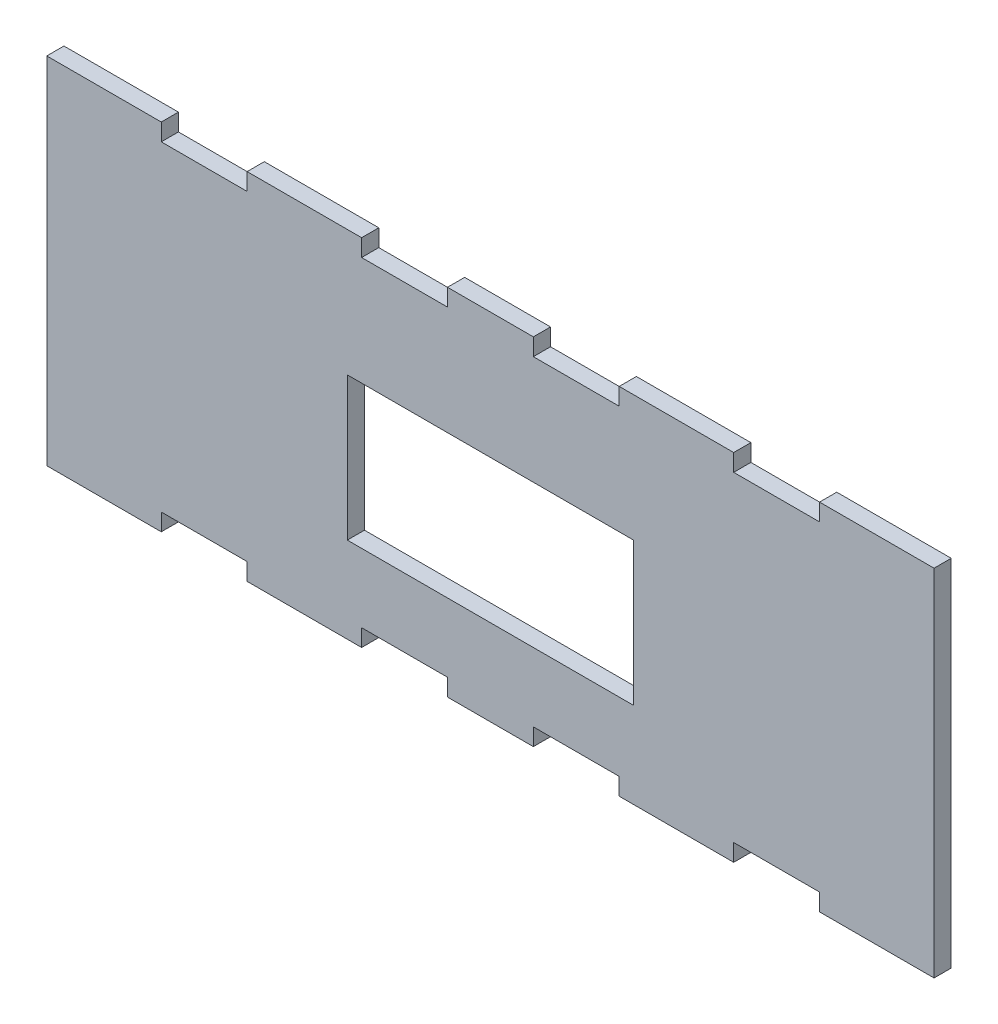
from build123d import *

# Parameters (mm, degrees)
P_IDAT_VYSUNUT_M1_DEPTH = 3


with BuildPart() as part:
    # Skica1 → Přidat vysunutím1 (new body)
    with BuildSketch(Plane.XY):
        Polygon((20, 3), (35, 3), (35, 0), (55, 0), (55, 3), (70, 3), (70, 0), (77.5, 0), (77.5, 15), (52.5, 15), (52.5, 40), (77.5, 40), (77.5, 62), (70, 62), (70, 59), (55, 59), (55, 62), (35, 62), (35, 59), (20, 59), (20, 62), (0, 62), (0, 0), (20, 0), align=None)
    p_idat_vysunut_m1 = extrude(amount=P_IDAT_VYSUNUT_M1_DEPTH)

    # Zrcadlit1: Přidat vysunutím1 across plane
    add(p_idat_vysunut_m1.mirror(Plane(origin=(77.5, 0, 3), x_dir=(0, 0, 1), z_dir=(-1, 0, 0))))


solid = part.part
